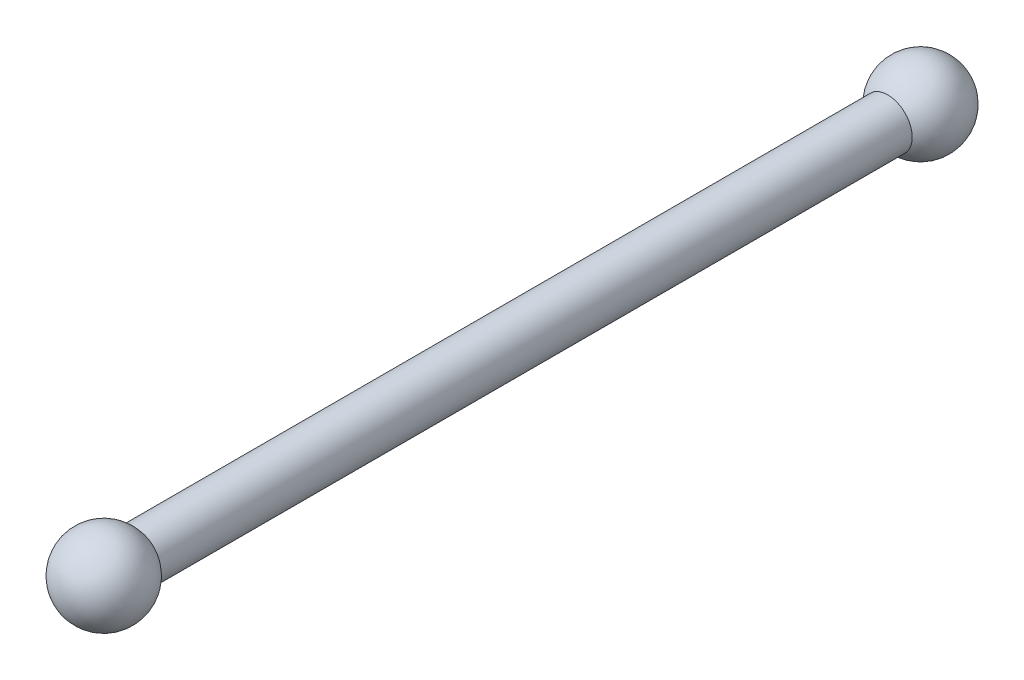
from build123d import *

# Parameters (mm, degrees)
SZKIC1_R                    = 1.5
DODANIE_WYCI_GNI_CIE1_DEPTH = 25


with BuildPart() as part:
    # Szkic1 → Dodanie-wyciągnięcie1 (new, symmetric)
    with BuildSketch(Plane.XY):
        Circle(SZKIC1_R)
    extrude(amount=DODANIE_WYCI_GNI_CIE1_DEPTH, both=True)

    # Szkic2 → Obrót1 (revolve)
    with BuildSketch(Plane(origin=(0, 0, 0), x_dir=(1, 0, 0), z_dir=(0, 1, 0))):
        with BuildLine():
            ThreePointArc((0, -27.5), (2.5, -25), (0, -22.5))
            Line((0, -22.5), (0, -25))
            Line((0, -25), (0, -27.5))
        make_face()
        with BuildLine():
            Line((0, 25), (0, 22.5))
            ThreePointArc((0, 22.5), (2.5, 25), (0, 27.5))
            Line((0, 27.5), (0, 25))
        make_face()
    revolve(axis=Axis((0, 0, 0), (0, 0, -1)))


solid = part.part
